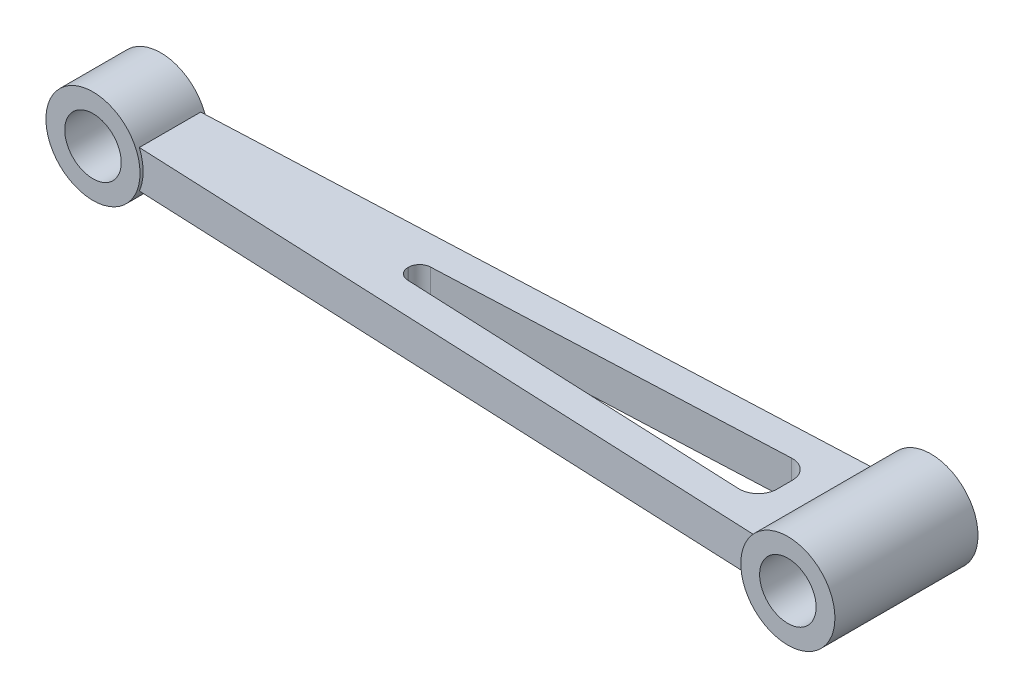
from build123d import *

# Parameters (mm, degrees)
SKETCH1_R           = 12.5
BOSS_EXTRUDE1_DEPTH = 9
SKETCH2_R           = 12.5
BOSS_EXTRUDE2_DEPTH = 19
BOSS_EXTRUDE3_DEPTH = 5
CUT_EXTRUDE1_DEPTH  = 26.5
SKETCH5_R           = 7.5
CUT_EXTRUDE2_DEPTH  = 26.5


with BuildPart() as part:
    # Sketch1 → Boss-Extrude1 (new, symmetric)
    with BuildSketch(Plane.XY):
        with Locations((-97.28, 0)):
            Circle(SKETCH1_R)
    extrude(amount=BOSS_EXTRUDE1_DEPTH, both=True)



with BuildPart() as body_2:
    # Sketch2 → Boss-Extrude2 (new, symmetric)
    with BuildSketch(Plane.XY):
        with Locations((97.28, 0)):
            Circle(SKETCH2_R)
    extrude(amount=BOSS_EXTRUDE2_DEPTH, both=True)


with BuildPart() as part_1:
    add(part.part)

    add(body_2.part)  # Boss-Extrude3 merges body 2
    # Sketch3 → Boss-Extrude3 (add, symmetric)
    with BuildSketch(Plane(origin=(0, 0, 0), x_dir=(1, 0, 0), z_dir=(0, 1, 0))):
        Polygon((-97.28, 7.645187817), (97.28, 16.139860869), (97.28, -16.139860869), (-97.28, -7.645187817), align=None)
    extrude(amount=BOSS_EXTRUDE3_DEPTH, both=True)

    # Sketch4 → Cut-Extrude1 (cut, symmetric)
    with BuildSketch(Plane(origin=(0, 5, 0), x_dir=(1, 0, 0), z_dir=(0, 1, 0))):
        with BuildLine():
            Line((72.223918829, 7.038267258), (-19.688842396, 3.025269438))
            ThreePointArc((-19.688842396, 3.025269438), (-21.72507612, 2.102663941), (-22.557984234, 0.028124773))
            Line((-22.557984234, 0.028124773), (-22.557984234, -0.028124773))
            ThreePointArc((-22.557984234, -0.028124773), (-21.72507612, -2.102663941), (-19.688842396, -3.025269438))
            Line((-19.688842396, -3.025269438), (72.223918829, -7.038267258))
            ThreePointArc((72.223918829, -7.038267258), (75.899581045, -5.654845961), (77.442015766, -2.04302615))
            Line((77.442015766, -2.04302615), (77.442015766, 2.04302615))
            ThreePointArc((77.442015766, 2.04302615), (75.899581045, 5.654845961), (72.223918829, 7.038267258))
        make_face()
    extrude(amount=CUT_EXTRUDE1_DEPTH, both=True, mode=Mode.SUBTRACT)

    # Sketch5 → Cut-Extrude2 (cut, symmetric)
    with BuildSketch(Plane.XY):
        with Locations((-97.28, 0)):
            Circle(SKETCH5_R)
        with Locations((97.28, 0)):
            Circle(SKETCH5_R)
    extrude(amount=CUT_EXTRUDE2_DEPTH, both=True, mode=Mode.SUBTRACT)


solid = part_1.part
